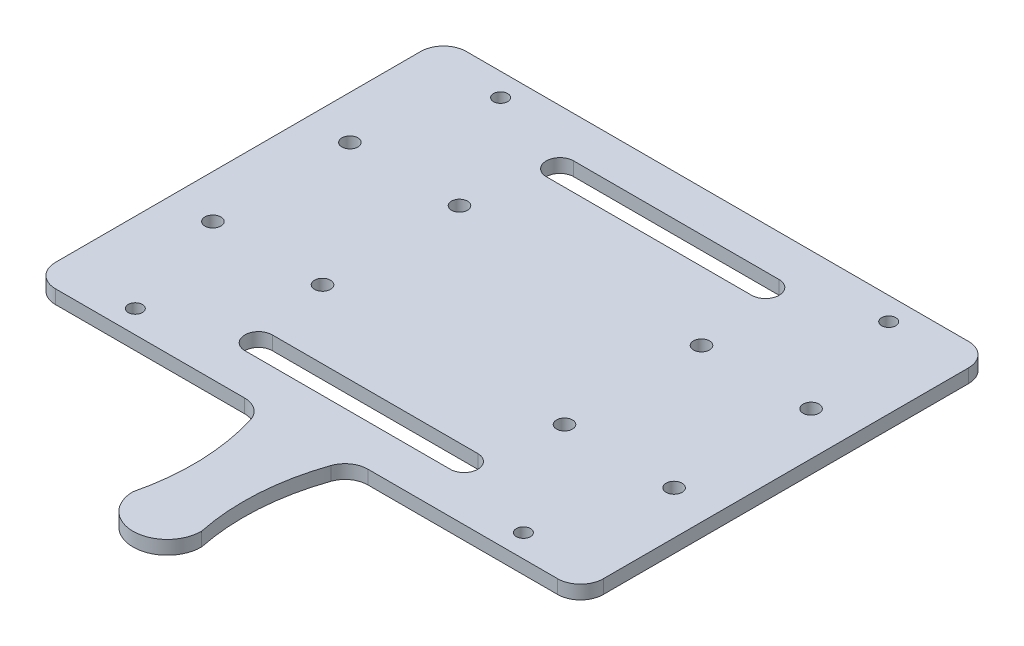
from build123d import *

# Parameters (mm, degrees)
SKETCH1_W           = 120
SKETCH1_H           = 90
BOSS_EXTRUDE1_DEPTH = 3
FILLET_1_R          = 5
CUT_EXTRUDE_1_DEPTH = 76.059976019
EXTRUDE_1_DEPTH     = 3
SKETCH_3_R          = 1.55
SKETCH_3_R_2        = 1.75
CUT_EXTRUDE_2_DEPTH = 103.055132159
FILLET_2_R          = 5


with BuildPart() as part:
    # Sketch1 → Boss-Extrude1 (new body)
    with BuildSketch(Plane(origin=(0, 0, 0), x_dir=(1, 0, 0), z_dir=(0, 1, 0))):
        Rectangle(SKETCH1_W, SKETCH1_H)
    extrude(amount=BOSS_EXTRUDE1_DEPTH)

    # 圆角1
    fillet_1_edges = [part.edges().sort_by_distance(p)[0] for p in [
        (60, 1.5, 45),
        (-60, 1.5, 45),
        (-60, 1.5, -45),
        (60, 1.5, -45),
    ]]
    fillet(fillet_1_edges, radius=FILLET_1_R)

    # 草图1 → 切除-拉伸1 (cut, through all)
    with BuildSketch(Plane(origin=(0, 3, 0), x_dir=(1, 0, 0), z_dir=(0, 1, 0))):
        with BuildLine():
            Line((-22.5, 36), (22.5, 36))
            ThreePointArc((22.5, 36), (25.5, 33), (22.5, 30))
            Line((22.5, 30), (-22.5, 30))
            ThreePointArc((-22.5, 30), (-25.5, 33), (-22.5, 36))
        make_face()
        with BuildLine():
            Line((-22.5, -30), (22.5, -30))
            ThreePointArc((22.5, -30), (25.5, -33), (22.5, -36))
            Line((22.5, -36), (-22.5, -36))
            ThreePointArc((-22.5, -36), (-25.5, -33), (-22.5, -30))
        make_face()
    extrude(amount=-CUT_EXTRUDE_1_DEPTH, mode=Mode.SUBTRACT)

    # 草图2 → 凸台-拉伸1 (add)
    with BuildSketch(Plane(origin=(0, 3, 0), x_dir=(1, 0, 0), z_dir=(0, 1, 0))):
        with BuildLine():
            Line((-10, -45), (10, -45))
            ThreePointArc((10, -45), (6.18491446, -59.768491446), (7, -75))
            ThreePointArc((7, -75), (-0.5, -82.5), (-8, -75))
            ThreePointArc((-8, -75), (-6.691600161, -59.846106677), (-10, -45))
        make_face()
    extrude(amount=-EXTRUDE_1_DEPTH)

    # 草图3 → 切除-拉伸2 (cut, through all)
    with BuildSketch(Plane(origin=(0, 3, 0), x_dir=(1, 0, 0), z_dir=(0, 1, 0))):
        with Locations(Location((42.5, -40, 0), (0, 0, 270))):
            Circle(SKETCH_3_R)
        with Locations(Location((42.5, 40, 0), (0, 0, 270))):
            Circle(SKETCH_3_R)
        with Locations(Location((-42.5, -40, 0), (0, 0, 270))):
            Circle(SKETCH_3_R)
        with Locations(Location((-42.5, 40, 0), (0, 0, 270))):
            Circle(SKETCH_3_R)
        with Locations(Location((-50.5, -15, 0), (0, 0, 270))):
            Circle(SKETCH_3_R_2)
        with Locations(Location((-26.5, -15, 0), (0, 0, 270))):
            Circle(SKETCH_3_R_2)
        with Locations(Location((-26.5, 15, 0), (0, 0, 270))):
            Circle(SKETCH_3_R_2)
        with Locations(Location((-50.5, 15, 0), (0, 0, 270))):
            Circle(SKETCH_3_R_2)
        with Locations(Location((50.5, -15, 0), (0, 0, 270))):
            Circle(SKETCH_3_R_2)
        with Locations(Location((50.5, 15, 0), (0, 0, 270))):
            Circle(SKETCH_3_R_2)
        with Locations(Location((26.5, -15, 0), (0, 0, 270))):
            Circle(SKETCH_3_R_2)
        with Locations(Location((26.5, 15, 0), (0, 0, 270))):
            Circle(SKETCH_3_R_2)
    extrude(amount=-CUT_EXTRUDE_2_DEPTH, mode=Mode.SUBTRACT)

    # 圆角2
    fillet_2_edges = [part.edges().sort_by_distance(p)[0] for p in [
        (10, 1.5, 45),
        (-10, 1.5, 45),
    ]]
    fillet(fillet_2_edges, radius=FILLET_2_R)


solid = part.part
